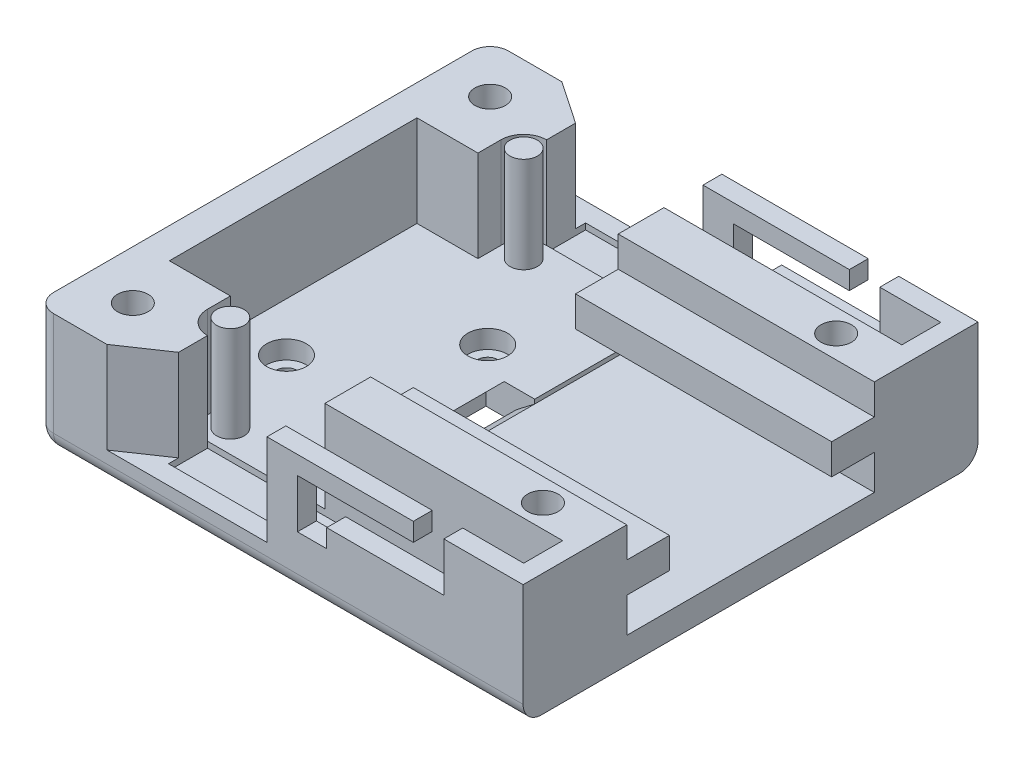
from build123d import *

# Parameters (mm, degrees)
SKETCH2_R           = 2.25
BOSS_EXTRUDE1_DEPTH = 15
SKETCH3_W           = 80
SKETCH3_H           = 37.3
BOSS_EXTRUDE2_DEPTH = 3
SKETCH2_6_W         = 39
SKETCH2_6_H         = 6.4
CUT_EXTRUDE1_DEPTH  = 1
CUT_EXTRUDE4_DEPTH  = 3.1
SKETCH5_W           = 42
SKETCH5_H           = 5
BOSS_EXTRUDE3_DEPTH = 7
SKETCH6_W           = 40.4
SKETCH6_H           = 20.3
CUT_EXTRUDE5_DEPTH  = 0.7
CUT_EXTRUDE6_DEPTH  = 5
SKETCH8_R           = 2.5
CUT_EXTRUDE7_DEPTH  = 5
SKETCH9_R           = 3.25
SKETCH9_R_2         = 1.7
CUT_EXTRUDE8_DEPTH  = 2
SKETCH10_R          = 1.7
CUT_EXTRUDE10_DEPTH = 92.27783365
SKETCH11_R          = 2.25
BOSS_EXTRUDE4_DEPTH = 0.7
SKETCH12_R          = 2.25
BOSS_EXTRUDE5_DEPTH = 0.7
SKETCH13_W          = 80
SKETCH13_H          = 74.6
SKETCH13_R          = 1.7
SKETCH13_W_2        = 5
SKETCH13_H_2        = 10
BOSS_EXTRUDE6_DEPTH = 2
FILLET1_R           = 3
SKETCH14_R          = 3.25
CUT_EXTRUDE11_DEPTH = 1


with BuildPart() as part:
    # Sketch2 → Boss-Extrude1 (new body)
    with BuildSketch(Plane(origin=(0, 0, 0), x_dir=(1, 0, 0), z_dir=(0, 1, 0))):
        Polygon((69.743853574, -17.657592215), (69.743853574, -0.657592215), (27.743853574, -0.657592215), (27.743853574, -8.157592215), (66.743853574, -8.157592215), (66.743853574, -14.557592215), (27.743853574, -14.557592215), (27.743853574, -17.657592215), align=None)
        with Locations(Location((8.493853574, -4.407592215, 0), (0, 0, 270))):
            Circle(SKETCH2_R)
        with BuildLine():
            ThreePointArc((8.493853574, -8.157592215), (5.842203145, -7.059242644), (4.743853574, -4.407592215))
            Line((4.743853574, -4.407592215), (4.743853574, -15.452235072))
            Line((4.743853574, -15.452235072), (8.493853574, -12.907592215))
            Line((8.493853574, -12.907592215), (8.493853574, -8.157592215))
        make_face()
        Polygon((-5.256146426, -0.657592215), (-5.256146426, 19.642407785), (-10.256146426, 19.642407785), (-10.256146426, -17.657592215), (1.493853574, -17.657592215), (4.743853574, -15.452235072), (4.743853574, -4.407592215), (4.743853574, -0.657592215), align=None)
    extrude(amount=BOSS_EXTRUDE1_DEPTH)

    # Sketch3 → Boss-Extrude2 (add)
    with BuildSketch(Plane(origin=(0, 0, 0), x_dir=(-1, 0, 0), z_dir=(0, -1, 0))):
        with Locations((-29.743853574, 0.992407785)):
            Rectangle(SKETCH3_W, SKETCH3_H)
    extrude(amount=BOSS_EXTRUDE2_DEPTH)

    # Sketch2<6> → Cut-Extrude1 (cut)
    with BuildSketch(Plane(origin=(0, 0, 0), x_dir=(1, 0, 0), z_dir=(0, 1, 0))):
        Polygon((27.743853574, -8.157592215), (8.493853574, -8.157592215), (8.493853574, -12.907592215), (8.493853574, -14.557592215), (27.743853574, -14.557592215), align=None)
        with Locations((47.243853574, -11.357592215)):
            Rectangle(SKETCH2_6_W, SKETCH2_6_H)
    extrude(amount=-CUT_EXTRUDE1_DEPTH, mode=Mode.SUBTRACT)

    # Sketch4 → Cut-Extrude4 (cut)
    with BuildSketch(Plane.XY.offset(17.657592215)):
        Polygon((37.543853574, 7), (56.743853574, 7), (56.743853574, 15), (51.743853574, 15), (51.743853574, 12), (32.743853574, 12), (32.743853574, 4), (37.543853574, 4), align=None)
    extrude(amount=-CUT_EXTRUDE4_DEPTH, mode=Mode.SUBTRACT)

    # Sketch5 → Boss-Extrude3 (add)
    with BuildSketch(Plane(origin=(0, 0, 0.657592215), x_dir=(-1, 0, 0), z_dir=(0, 0, -1))):
        with Locations((-48.743853574, 7.5)):
            Rectangle(SKETCH5_W, SKETCH5_H)
    extrude(amount=BOSS_EXTRUDE3_DEPTH)

    # Sketch6 → Cut-Extrude5 (cut)
    with BuildSketch(Plane(origin=(0, 0, 0), x_dir=(1, 0, 0), z_dir=(0, 1, 0))):
        with Locations((49.543853574, 9.492407785)):
            Rectangle(SKETCH6_W, SKETCH6_H)
    extrude(amount=-CUT_EXTRUDE5_DEPTH, mode=Mode.SUBTRACT)

    # Sketch7 → Cut-Extrude6 (cut)
    with BuildSketch(Plane(origin=(0, 0, -19.642407785), x_dir=(-1, 0, 0), z_dir=(0, 0, -1))):
        Polygon((-29.343853574, -0.7), (-26.343853574, -3), (-21.343853574, -3), (-24.343853574, 0), (-29.343853574, 0), align=None)
    extrude(amount=-CUT_EXTRUDE6_DEPTH, mode=Mode.SUBTRACT)

    # Sketch8 → Cut-Extrude7 (cut)
    with BuildSketch(Plane(origin=(0, 15, 0), x_dir=(1, 0, 0), z_dir=(0, 1, 0))):
        with Locations(Location((-2.256146426, -9.657592215, 0), (0, 0, 270))):
            Circle(SKETCH8_R)
        with Locations(Location((59.743853574, -4.407592215, 0), (0, 0, 270))):
            Circle(SKETCH8_R)
    extrude(amount=-CUT_EXTRUDE7_DEPTH, mode=Mode.SUBTRACT)

    # Mirror1: part across plane


with BuildPart() as part_1:
    add(part.part)
    add(part.part.mirror(Plane(origin=(-10.256146426, -3, -19.642407785), x_dir=(1, 0, 0), z_dir=(0, 0, 1))))

    # Sketch9 → Cut-Extrude8 (cut)
    # profile 1 of 3: a face of its own
    with BuildSketch(Plane(origin=(0, 0, 0), x_dir=(1, 0, 0), z_dir=(0, 1, 0))):
        with Locations(Location((17.743853574, 28.542407785, 0), (0, 0, 270))):
            Circle(SKETCH9_R)
        with Locations(Location((17.743853574, 28.542407785, 0), (0, 0, 270))):
            Circle(SKETCH9_R_2, mode=Mode.SUBTRACT)
    # profile 2 of 3: a face of its own
    with BuildSketch(Plane(origin=(0, 0, 0), x_dir=(1, 0, 0), z_dir=(0, 1, 0))):
        with Locations(Location((17.743853574, 10.542407785, 0), (0, 0, 270))):
            Circle(SKETCH9_R)
        with Locations(Location((17.743853574, 10.542407785, 0), (0, 0, 270))):
            Circle(SKETCH9_R_2, mode=Mode.SUBTRACT)
    # profile 3 of 3: a face of its own
    with BuildSketch(Plane(origin=(0, 0, 0), x_dir=(1, 0, 0), z_dir=(0, 1, 0))):
        with Locations(Location((2.743853574, 10.542407785, 0), (0, 0, 270))):
            Circle(SKETCH9_R)
        with Locations(Location((2.743853574, 10.542407785, 0), (0, 0, 270))):
            Circle(SKETCH9_R_2, mode=Mode.SUBTRACT)
    extrude(amount=-CUT_EXTRUDE8_DEPTH, mode=Mode.SUBTRACT)

    # Sketch10 → Cut-Extrude10 (cut, through all)
    with BuildSketch(Plane(origin=(0, 0, 0), x_dir=(1, 0, 0), z_dir=(0, 1, 0))):
        with Locations(Location((17.743853574, 28.542407785, 0), (0, 0, 270))):
            Circle(SKETCH10_R)
        with Locations(Location((17.743853574, 10.542407785, 0), (0, 0, 270))):
            Circle(SKETCH10_R)
        with Locations(Location((2.743853574, 10.542407785, 0), (0, 0, 270))):
            Circle(SKETCH10_R)
    extrude(amount=-CUT_EXTRUDE10_DEPTH, mode=Mode.SUBTRACT)

    # Sketch11 → Boss-Extrude4 (add)
    with BuildSketch(Plane(origin=(0, 15, 0), x_dir=(1, 0, 0), z_dir=(0, 1, 0))):
        with Locations(Location((8.493853574, -4.407592215, 0), (0, 0, 270))):
            Circle(SKETCH11_R)
    extrude(amount=BOSS_EXTRUDE4_DEPTH)

    # Sketch12 → Boss-Extrude5 (add)
    with BuildSketch(Plane(origin=(0, 15, 0), x_dir=(1, 0, 0), z_dir=(0, 1, 0))):
        with Locations(Location((8.493853574, 43.692407785, 0), (0, 0, 270))):
            Circle(SKETCH12_R)
    extrude(amount=BOSS_EXTRUDE5_DEPTH)

    # Sketch13 → Boss-Extrude6 (add)
    with BuildSketch(Plane(origin=(0, -3, 0), x_dir=(-1, 0, 0), z_dir=(0, -1, 0))):
        with Locations((-29.743853574, 19.642407785)):
            Rectangle(SKETCH13_W, SKETCH13_H)
        with Locations(Location((-17.743853574, 28.542407785, 0), (0, 0, 270))):
            Circle(SKETCH13_R, mode=Mode.SUBTRACT)
        with Locations(Location((-17.743853574, 10.542407785, 0), (0, 0, 270))):
            Circle(SKETCH13_R, mode=Mode.SUBTRACT)
        with Locations(Location((-2.743853574, 10.542407785, 0), (0, 0, 270))):
            Circle(SKETCH13_R, mode=Mode.SUBTRACT)
        with Locations((-23.843853574, 19.642407785)):
            Rectangle(SKETCH13_W_2, SKETCH13_H_2, mode=Mode.SUBTRACT)
    extrude(amount=BOSS_EXTRUDE6_DEPTH)

    # Fillet1
    fillet1_edges = [part_1.edges().sort_by_distance(p)[0] for p in [
        (-10.256146426, 5, -56.942407785),
        (-10.256146426, 5, 17.657592215),
        (-10.256146426, -5, -19.642407785),
        (29.743853574, -5, -56.942407785),
        (29.743853574, -5, 17.657592215),
    ]]
    fillet(fillet1_edges, radius=FILLET1_R)

    # Sketch14 → Cut-Extrude11 (cut)
    with BuildSketch(Plane(origin=(0, -2, 0), x_dir=(1, 0, 0), z_dir=(0, 1, 0))):
        with Locations(Location((17.743853574, 28.542407785, 0), (0, 0, 270))):
            Circle(SKETCH14_R)
        with Locations(Location((17.743853574, 10.542407785, 0), (0, 0, 270))):
            Circle(SKETCH14_R)
        with Locations(Location((2.743853574, 10.542407785, 0), (0, 0, 270))):
            Circle(SKETCH14_R)
    extrude(amount=-CUT_EXTRUDE11_DEPTH, mode=Mode.SUBTRACT)


solid = part_1.part
